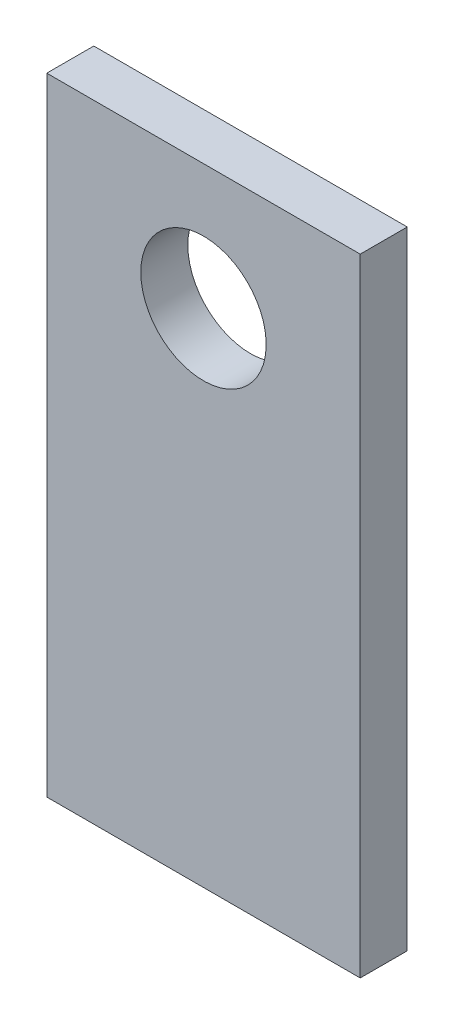
from build123d import *

# Parameters (mm, degrees)
SKETCH1_W           = 63.5
SKETCH1_H           = 127
SKETCH1_R           = 12.7
BOSS_EXTRUDE1_DEPTH = 9.525


with BuildPart() as part:
    # Sketch1 → Boss-Extrude1 (new body)
    with BuildSketch(Plane.XY):
        with Locations((31.75, 63.5)):
            Rectangle(SKETCH1_W, SKETCH1_H)
        with Locations(Location((31.75, 101.6, 0), (0, 0, 180))):
            Circle(SKETCH1_R, mode=Mode.SUBTRACT)
    extrude(amount=BOSS_EXTRUDE1_DEPTH)


solid = part.part
